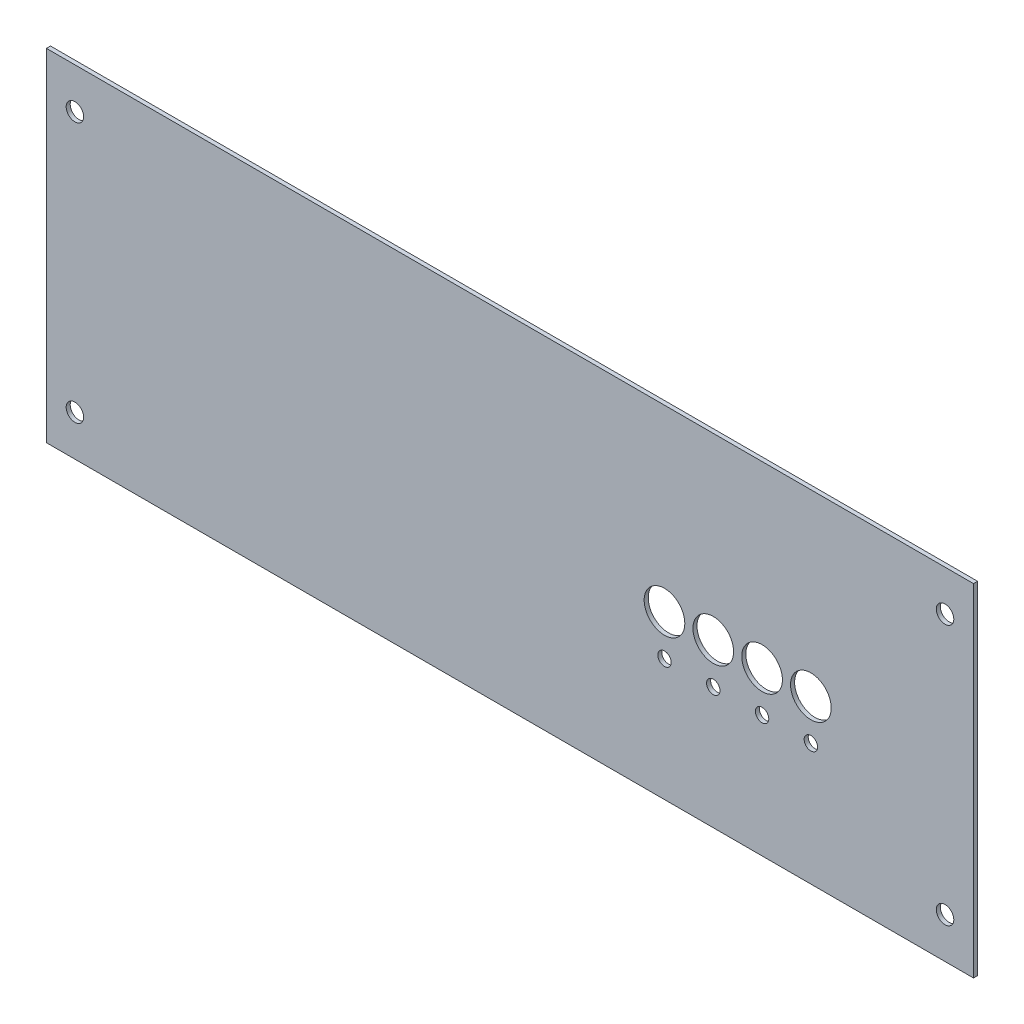
from build123d import *

# Parameters (mm, degrees)
SKETCH_1_W      = 228
SKETCH_1_H      = 84
SKETCH_1_R      = 5
SKETCH_1_R_2    = 1.65
SKETCH_1_R_3    = 2.15
EXTRUDE_1_DEPTH = 1


with BuildPart() as part:
    # Эскиз1 → Вытянуть1 (new body)
    with BuildSketch(Plane.XY):
        Rectangle(SKETCH_1_W, SKETCH_1_H)
        with Locations((74, -2)):
            Circle(SKETCH_1_R, mode=Mode.SUBTRACT)
        with Locations((74, -12)):
            Circle(SKETCH_1_R_2, mode=Mode.SUBTRACT)
        with Locations((62, -2)):
            Circle(SKETCH_1_R, mode=Mode.SUBTRACT)
        with Locations((62, -12)):
            Circle(SKETCH_1_R_2, mode=Mode.SUBTRACT)
        with Locations((50, -2)):
            Circle(SKETCH_1_R, mode=Mode.SUBTRACT)
        with Locations((50, -12)):
            Circle(SKETCH_1_R_2, mode=Mode.SUBTRACT)
        with Locations((38, -2)):
            Circle(SKETCH_1_R, mode=Mode.SUBTRACT)
        with Locations((38, -12)):
            Circle(SKETCH_1_R_2, mode=Mode.SUBTRACT)
        with Locations((107, 32)):
            Circle(SKETCH_1_R_3, mode=Mode.SUBTRACT)
        with Locations(Location((-107, 32, 0), (0, 0, 180))):
            Circle(SKETCH_1_R_3, mode=Mode.SUBTRACT)
        with Locations((-107, -32)):
            Circle(SKETCH_1_R_3, mode=Mode.SUBTRACT)
        with Locations(Location((107, -32, 0), (0, 0, 180))):
            Circle(SKETCH_1_R_3, mode=Mode.SUBTRACT)
    extrude(amount=EXTRUDE_1_DEPTH)


solid = part.part
